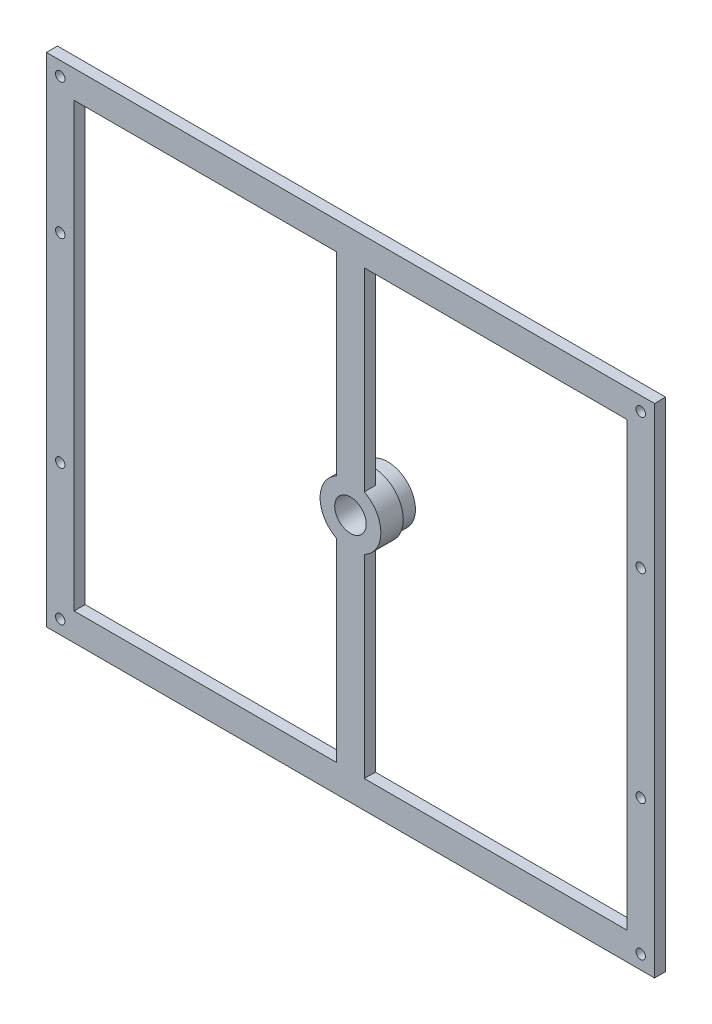
from build123d import *

# Parameters (mm, degrees)
UPPER_PERIMETER_START                         = 304
SKETCH1_W                                     = 220
SKETCH1_H                                     = 180
SKETCH1_W_2                                   = 200
SKETCH1_H_2                                   = 160
UPPER_PERIMETER_DEPTH                         = 4
BEARING_SPINE_START                           = 304
SKETCH2_W                                     = 10
SKETCH2_H                                     = 170
BEARING_SPINE_DEPTH                           = 4
UPPER_OUTER_RACE_STOP_START                   = 299.9
SKETCH3_R                                     = 11
SKETCH3_R_2                                   = 5.7
UPPER_OUTER_RACE_STOP_DEPTH                   = 8.1
FLOATING_OUTER_RACE_SEAT_START                = 294.5
SKETCH4_R                                     = 10
SKETCH4_R_2                                   = 6.5
FLOATING_OUTER_RACE_SEAT_DEPTH                = 5.41
SHAFT_CLIP_CLEARANCE_START                    = -8.11
SKETCH5_R                                     = 5.7
SHAFT_CLIP_CLEARANCE_DEPTH                    = 8.11
SKETCH6_R                                     = 1.7
FOUR_TIE_ROD_CLEARANCE_DEPTH                  = 4.01
SKETCH7_R                                     = 1
THREE_M2_TOP_CAP_THREAD_MAJOR_ENVELOPES_DEPTH = 4.3
SKETCH8_R                                     = 1.7
BENCH_MOTOR_CROSSBEAM_FOUR_D3P4_DEPTH         = 4.01


with BuildPart() as part:
    # Sketch1 → Upper_Perimeter (new body)
    with BuildSketch(Plane.XY.offset(UPPER_PERIMETER_START)):
        Rectangle(SKETCH1_W, SKETCH1_H)
        Rectangle(SKETCH1_W_2, SKETCH1_H_2, mode=Mode.SUBTRACT)
    extrude(amount=UPPER_PERIMETER_DEPTH)

    # Sketch2 → Bearing_Spine (add)
    with BuildSketch(Plane.XY.offset(BEARING_SPINE_START)):
        Rectangle(SKETCH2_W, SKETCH2_H)
    extrude(amount=BEARING_SPINE_DEPTH)

    # Sketch3 → Upper_Outer_Race_Stop (add)
    with BuildSketch(Plane.XY.offset(UPPER_OUTER_RACE_STOP_START)):
        with Locations(Location((0, 0, 0), (0, 0, 117.035691789))):
            Circle(SKETCH3_R)
        with Locations(Location((0, 0, 0), (0, 0, 208.694413527))):
            Circle(SKETCH3_R_2, mode=Mode.SUBTRACT)
    extrude(amount=UPPER_OUTER_RACE_STOP_DEPTH)

    # Sketch4 → Floating_Outer_Race_Seat (add)
    with BuildSketch(Plane.XY.offset(FLOATING_OUTER_RACE_SEAT_START)):
        Circle(SKETCH4_R)
        Circle(SKETCH4_R_2, mode=Mode.SUBTRACT)
    extrude(amount=FLOATING_OUTER_RACE_SEAT_DEPTH)

    # Sketch5 → Shaft_Clip_Clearance (cut)
    with BuildSketch(Plane.XY.offset(308).offset(SHAFT_CLIP_CLEARANCE_START)):
        Circle(SKETCH5_R)
    extrude(amount=SHAFT_CLIP_CLEARANCE_DEPTH, mode=Mode.SUBTRACT)

    # Sketch6 → Four_Tie_Rod_Clearance (cut)
    with BuildSketch(Plane.XY.offset(308)):
        with Locations((-105, -85)):
            Circle(SKETCH6_R)
        with Locations((-105, 85)):
            Circle(SKETCH6_R)
        with Locations((105, -85)):
            Circle(SKETCH6_R)
        with Locations((105, 85)):
            Circle(SKETCH6_R)
    extrude(amount=-FOUR_TIE_ROD_CLEARANCE_DEPTH, mode=Mode.SUBTRACT)

    # Sketch7 → Three_M2_Top_Cap_Thread_Major_Envelopes (cut)
    with BuildSketch(Plane(origin=(0, 0, 294.5), x_dir=(-1, 0, 0), z_dir=(0, 0, -1))):
        with Locations((-7.188010851, 4.15)):
            Circle(SKETCH7_R)
        with Locations((7.188010851, 4.15)):
            Circle(SKETCH7_R)
        with Locations((0, -8.3)):
            Circle(SKETCH7_R)
    extrude(amount=-THREE_M2_TOP_CAP_THREAD_MAJOR_ENVELOPES_DEPTH, mode=Mode.SUBTRACT)

    # Sketch8 → Bench_Motor_Crossbeam_Four_D3p4 (cut)
    with BuildSketch(Plane.XY.offset(308)):
        with Locations((-105, -36)):
            Circle(SKETCH8_R)
        with Locations((-105, 36)):
            Circle(SKETCH8_R)
        with Locations((105, -36)):
            Circle(SKETCH8_R)
        with Locations((105, 36)):
            Circle(SKETCH8_R)
    extrude(amount=-BENCH_MOTOR_CROSSBEAM_FOUR_D3P4_DEPTH, mode=Mode.SUBTRACT)


solid = part.part
